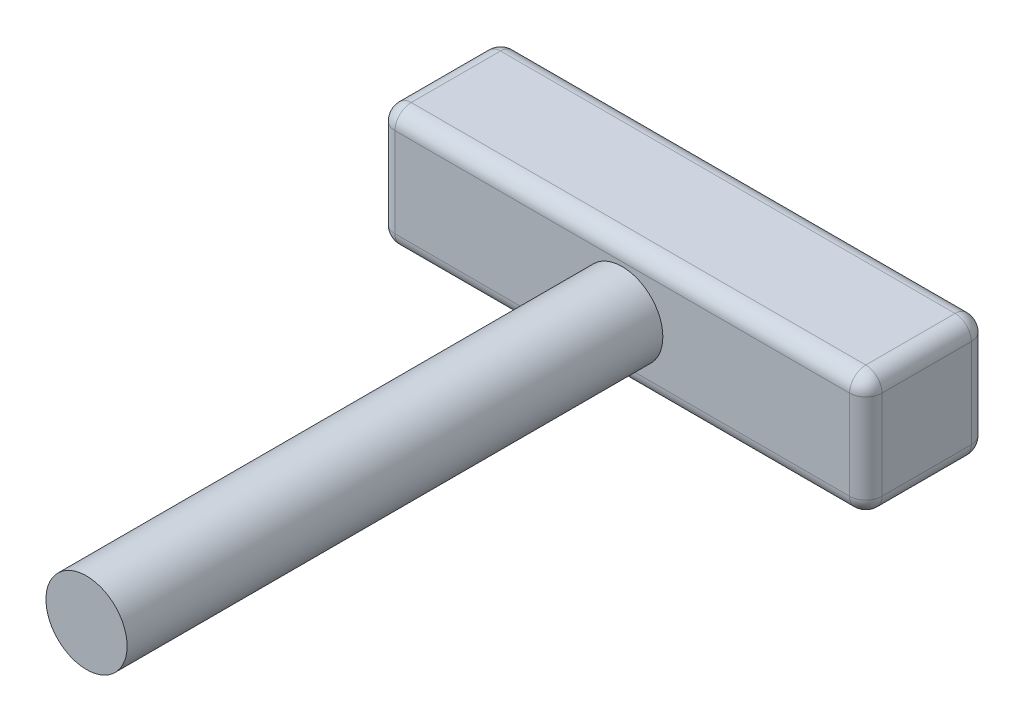
from build123d import *

# Parameters (mm, degrees)
SKETCH1_W           = 15
SKETCH1_H           = 15
BOSS_EXTRUDE1_DEPTH = 60
SKETCH3_R           = 5
BOSS_EXTRUDE2_DEPTH = 66
FILLET1_R           = 2


with BuildPart() as part:
    # Sketch1 → Boss-Extrude1 (new body)
    with BuildSketch(Plane(origin=(0, 0, 0), x_dir=(0, 0, -1), z_dir=(1, 0, 0))):
        Rectangle(SKETCH1_W, SKETCH1_H)
    extrude(amount=BOSS_EXTRUDE1_DEPTH)

    # Sketch3 → Boss-Extrude2 (add)
    with BuildSketch(Plane.XY.offset(7.5)):
        with Locations((30, 0)):
            Circle(SKETCH3_R)
    extrude(amount=BOSS_EXTRUDE2_DEPTH)

    # Fillet1
    fillet1_edges = [part.edges().sort_by_distance(p)[0] for p in [
        (60, 0, -7.5),
        (60, -7.5, 0),
        (60, 0, 7.5),
        (0, -7.5, 0),
        (0, 0, -7.5),
        (0, 7.5, 0),
        (0, 0, 7.5),
        (60, 7.5, 0),
        (30, -7.5, 7.5),
        (30, -7.5, -7.5),
        (30, 7.5, -7.5),
        (30, 7.5, 7.5),
    ]]
    fillet(fillet1_edges, radius=FILLET1_R)


solid = part.part
